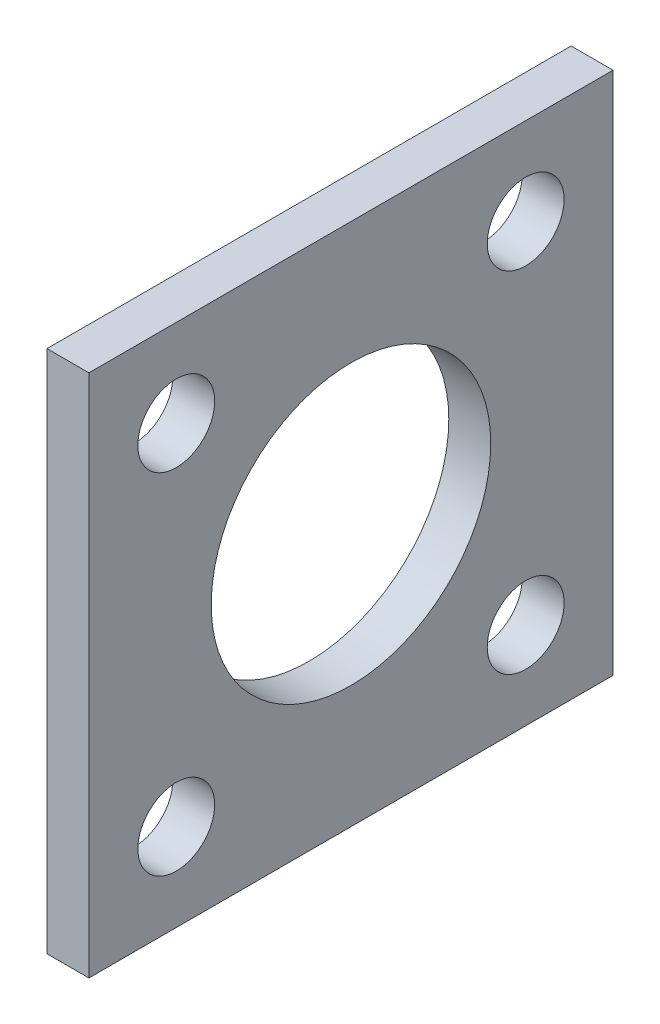
from build123d import *

# Parameters (mm, degrees)
SKETCH1_W           = 75
SKETCH1_H           = 75
SKETCH1_R           = 5.5
SKETCH1_R_2         = 20
BOSS_EXTRUDE1_DEPTH = 6


with BuildPart() as part:
    # Sketch1 → Boss-Extrude1 (new body)
    with BuildSketch(Plane(origin=(0, 0, 0), x_dir=(0, 0, -1), z_dir=(1, 0, 0))):
        Rectangle(SKETCH1_W, SKETCH1_H)
        with Locations((25, 25)):
            Circle(SKETCH1_R, mode=Mode.SUBTRACT)
        with Locations(Location((-25, 25, 0), (0, 0, 180))):
            Circle(SKETCH1_R, mode=Mode.SUBTRACT)
        with Locations(Location((25, -25, 0), (0, 0, 180))):
            Circle(SKETCH1_R, mode=Mode.SUBTRACT)
        with Locations((-25, -25)):
            Circle(SKETCH1_R, mode=Mode.SUBTRACT)
        Circle(SKETCH1_R_2, mode=Mode.SUBTRACT)
    extrude(amount=BOSS_EXTRUDE1_DEPTH)


solid = part.part
